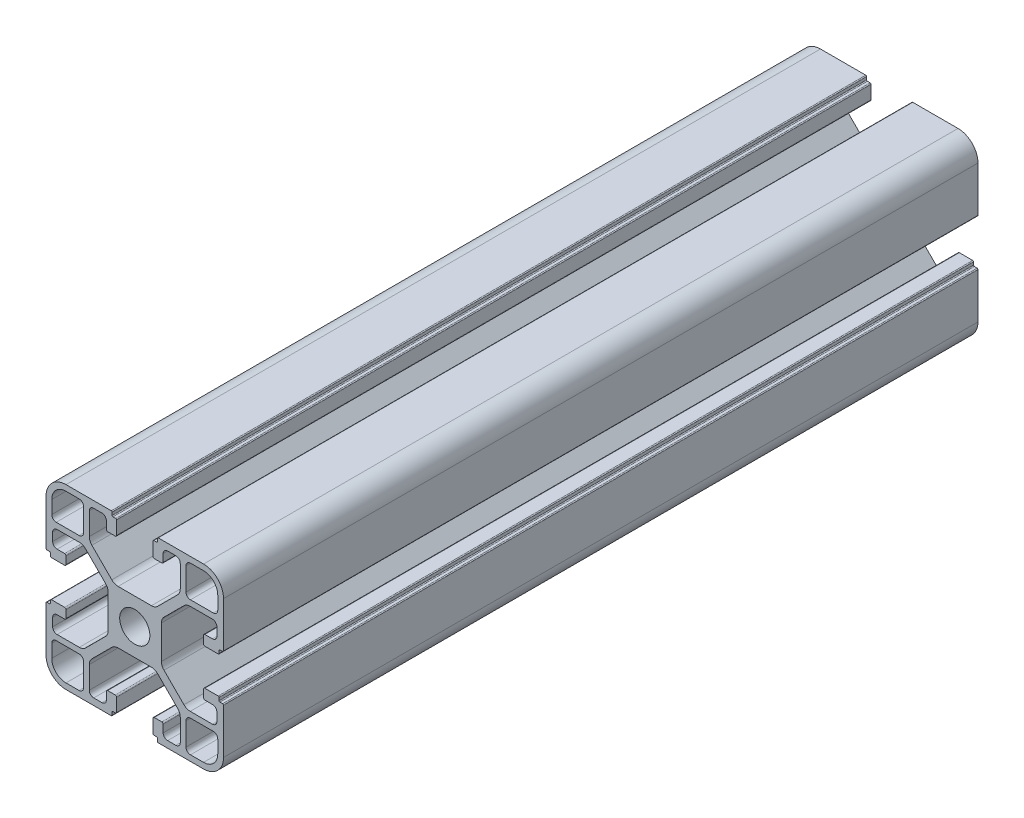
from build123d import *

# Parameters (mm, degrees)
SKETCH2_R           = 3.4
BOSS_EXTRUDE1_DEPTH = 170


with BuildPart() as part:
    # Sketch2 → Boss-Extrude1 (new body)
    with BuildSketch(Plane.XY):
        with BuildLine():
            Line((4.5, 0), (14.7, 0))
            ThreePointArc((14.7, 0), (14.841421356, 0.058578644), (14.9, 0.2))
            Line((14.9, 0.2), (14.9, 0.8))
            ThreePointArc((14.9, 0.8), (14.958578644, 0.941421356), (15.1, 1))
            Line((15.1, 1), (15.7, 1))
            ThreePointArc((15.7, 1), (15.841421356, 1.058578644), (15.9, 1.2))
            Line((15.9, 1.2), (15.9, 4.2))
            ThreePointArc((15.9, 4.2), (15.812132034, 4.412132034), (15.6, 4.5))
            Line((15.6, 4.5), (13.9, 4.5))
            ThreePointArc((13.9, 4.5), (13.687867966, 4.412132034), (13.6, 4.2))
            Line((13.6, 4.2), (13.6, 2.5))
            ThreePointArc((13.6, 2.5), (13.307106781, 1.792893219), (12.6, 1.5))
            Line((12.6, 1.5), (10.75, 1.5))
            ThreePointArc((10.75, 1.5), (10.042893219, 1.792893219), (9.75, 2.5))
            Line((9.75, 2.5), (9.75, 7.507359313))
            ThreePointArc((9.75, 7.507359313), (9.902240935, 8.272726178), (10.335786438, 8.921572875))
            Line((10.335786438, 8.921572875), (14.828427125, 13.414213562))
            ThreePointArc((14.828427125, 13.414213562), (15.477273822, 13.847759065), (16.242640687, 14))
            Line((16.242640687, 14), (23.757359313, 14))
            ThreePointArc((23.757359313, 14), (24.522726178, 13.847759065), (25.171572875, 13.414213562))
            Line((25.171572875, 13.414213562), (29.664213562, 8.921572875))
            ThreePointArc((29.664213562, 8.921572875), (30.097759065, 8.272726178), (30.25, 7.507359313))
            Line((30.25, 7.507359313), (30.25, 2.5))
            ThreePointArc((30.25, 2.5), (29.957106781, 1.792893219), (29.25, 1.5))
            Line((29.25, 1.5), (27.4, 1.5))
            ThreePointArc((27.4, 1.5), (26.692893219, 1.792893219), (26.4, 2.5))
            Line((26.4, 2.5), (26.4, 4.2))
            ThreePointArc((26.4, 4.2), (26.312132034, 4.412132034), (26.1, 4.5))
            Line((26.1, 4.5), (24.4, 4.5))
            ThreePointArc((24.4, 4.5), (24.187867966, 4.412132034), (24.1, 4.2))
            Line((24.1, 4.2), (24.1, 1.2))
            ThreePointArc((24.1, 1.2), (24.158578644, 1.058578644), (24.3, 1))
            Line((24.3, 1), (24.9, 1))
            ThreePointArc((24.9, 1), (25.041421356, 0.941421356), (25.1, 0.8))
            Line((25.1, 0.8), (25.1, 0.2))
            ThreePointArc((25.1, 0.2), (25.158578644, 0.058578644), (25.3, 0))
            Line((25.3, 0), (35.5, 0))
            ThreePointArc((35.5, 0), (38.681980515, 1.318019485), (40, 4.5))
            Line((40, 4.5), (40, 14.7))
            ThreePointArc((40, 14.7), (39.941421356, 14.841421356), (39.8, 14.9))
            Line((39.8, 14.9), (39.2, 14.9))
            ThreePointArc((39.2, 14.9), (39.058578644, 14.958578644), (39, 15.1))
            Line((39, 15.1), (39, 15.7))
            ThreePointArc((39, 15.7), (38.941421356, 15.841421356), (38.8, 15.9))
            Line((38.8, 15.9), (35.8, 15.9))
            ThreePointArc((35.8, 15.9), (35.587867966, 15.812132034), (35.5, 15.6))
            Line((35.5, 15.6), (35.5, 13.9))
            ThreePointArc((35.5, 13.9), (35.587867966, 13.687867966), (35.8, 13.6))
            Line((35.8, 13.6), (37.5, 13.6))
            ThreePointArc((37.5, 13.6), (38.207106781, 13.307106781), (38.5, 12.6))
            Line((38.5, 12.6), (38.5, 10.75))
            ThreePointArc((38.5, 10.75), (38.207106781, 10.042893219), (37.5, 9.75))
            Line((37.5, 9.75), (32.492640687, 9.75))
            ThreePointArc((32.492640687, 9.75), (31.727273822, 9.902240935), (31.078427125, 10.335786438))
            Line((31.078427125, 10.335786438), (26.585786438, 14.828427125))
            ThreePointArc((26.585786438, 14.828427125), (26.152240935, 15.477273822), (26, 16.242640687))
            Line((26, 16.242640687), (26, 23.757359313))
            ThreePointArc((26, 23.757359313), (26.152240935, 24.522726178), (26.585786438, 25.171572875))
            Line((26.585786438, 25.171572875), (31.078427125, 29.664213562))
            ThreePointArc((31.078427125, 29.664213562), (31.727273822, 30.097759065), (32.492640687, 30.25))
            Line((32.492640687, 30.25), (37.5, 30.25))
            ThreePointArc((37.5, 30.25), (38.207106781, 29.957106781), (38.5, 29.25))
            Line((38.5, 29.25), (38.5, 27.4))
            ThreePointArc((38.5, 27.4), (38.207106781, 26.692893219), (37.5, 26.4))
            Line((37.5, 26.4), (35.8, 26.4))
            ThreePointArc((35.8, 26.4), (35.587867966, 26.312132034), (35.5, 26.1))
            Line((35.5, 26.1), (35.5, 24.4))
            ThreePointArc((35.5, 24.4), (35.587867966, 24.187867966), (35.8, 24.1))
            Line((35.8, 24.1), (38.8, 24.1))
            ThreePointArc((38.8, 24.1), (38.941421356, 24.158578644), (39, 24.3))
            Line((39, 24.3), (39, 24.9))
            ThreePointArc((39, 24.9), (39.058578644, 25.041421356), (39.2, 25.1))
            Line((39.2, 25.1), (39.8, 25.1))
            ThreePointArc((39.8, 25.1), (39.941421356, 25.158578644), (40, 25.3))
            Line((40, 25.3), (40, 35.5))
            ThreePointArc((40, 35.5), (38.681980515, 38.681980515), (35.5, 40))
            Line((35.5, 40), (25.3, 40))
            ThreePointArc((25.3, 40), (25.158578644, 39.941421356), (25.1, 39.8))
            Line((25.1, 39.8), (25.1, 39.2))
            ThreePointArc((25.1, 39.2), (25.041421356, 39.058578644), (24.9, 39))
            Line((24.9, 39), (24.3, 39))
            ThreePointArc((24.3, 39), (24.158578644, 38.941421356), (24.1, 38.8))
            Line((24.1, 38.8), (24.1, 35.8))
            ThreePointArc((24.1, 35.8), (24.187867966, 35.587867966), (24.4, 35.5))
            Line((24.4, 35.5), (26.1, 35.5))
            ThreePointArc((26.1, 35.5), (26.312132034, 35.587867966), (26.4, 35.8))
            Line((26.4, 35.8), (26.4, 37.5))
            ThreePointArc((26.4, 37.5), (26.692893219, 38.207106781), (27.4, 38.5))
            Line((27.4, 38.5), (29.25, 38.5))
            ThreePointArc((29.25, 38.5), (29.957106781, 38.207106781), (30.25, 37.5))
            Line((30.25, 37.5), (30.25, 32.492640687))
            ThreePointArc((30.25, 32.492640687), (30.097759065, 31.727273822), (29.664213562, 31.078427125))
            Line((29.664213562, 31.078427125), (25.171572875, 26.585786438))
            ThreePointArc((25.171572875, 26.585786438), (24.522726178, 26.152240935), (23.757359313, 26))
            Line((23.757359313, 26), (16.242640687, 26))
            ThreePointArc((16.242640687, 26), (15.477273822, 26.152240935), (14.828427125, 26.585786438))
            Line((14.828427125, 26.585786438), (10.335786438, 31.078427125))
            ThreePointArc((10.335786438, 31.078427125), (9.902240935, 31.727273822), (9.75, 32.492640687))
            Line((9.75, 32.492640687), (9.75, 37.5))
            ThreePointArc((9.75, 37.5), (10.042893219, 38.207106781), (10.75, 38.5))
            Line((10.75, 38.5), (12.6, 38.5))
            ThreePointArc((12.6, 38.5), (13.307106781, 38.207106781), (13.6, 37.5))
            Line((13.6, 37.5), (13.6, 35.8))
            ThreePointArc((13.6, 35.8), (13.687867966, 35.587867966), (13.9, 35.5))
            Line((13.9, 35.5), (15.6, 35.5))
            ThreePointArc((15.6, 35.5), (15.812132034, 35.587867966), (15.9, 35.8))
            Line((15.9, 35.8), (15.9, 38.8))
            ThreePointArc((15.9, 38.8), (15.841421356, 38.941421356), (15.7, 39))
            Line((15.7, 39), (15.1, 39))
            ThreePointArc((15.1, 39), (14.958578644, 39.058578644), (14.9, 39.2))
            Line((14.9, 39.2), (14.9, 39.8))
            ThreePointArc((14.9, 39.8), (14.841421356, 39.941421356), (14.7, 40))
            Line((14.7, 40), (4.5, 40))
            ThreePointArc((4.5, 40), (1.318019485, 38.681980515), (0, 35.5))
            Line((0, 35.5), (0, 25.3))
            ThreePointArc((0, 25.3), (0.058578644, 25.158578644), (0.2, 25.1))
            Line((0.2, 25.1), (0.8, 25.1))
            ThreePointArc((0.8, 25.1), (0.941421356, 25.041421356), (1, 24.9))
            Line((1, 24.9), (1, 24.3))
            ThreePointArc((1, 24.3), (1.058578644, 24.158578644), (1.2, 24.1))
            Line((1.2, 24.1), (4.2, 24.1))
            ThreePointArc((4.2, 24.1), (4.412132034, 24.187867966), (4.5, 24.4))
            Line((4.5, 24.4), (4.5, 26.1))
            ThreePointArc((4.5, 26.1), (4.412132034, 26.312132034), (4.2, 26.4))
            Line((4.2, 26.4), (2.5, 26.4))
            ThreePointArc((2.5, 26.4), (1.792893219, 26.692893219), (1.5, 27.4))
            Line((1.5, 27.4), (1.5, 29.25))
            ThreePointArc((1.5, 29.25), (1.792893219, 29.957106781), (2.5, 30.25))
            Line((2.5, 30.25), (7.507359313, 30.25))
            ThreePointArc((7.507359313, 30.25), (8.272726178, 30.097759065), (8.921572875, 29.664213562))
            Line((8.921572875, 29.664213562), (13.414213562, 25.171572875))
            ThreePointArc((13.414213562, 25.171572875), (13.847759065, 24.522726178), (14, 23.757359313))
            Line((14, 23.757359313), (14, 16.242640687))
            ThreePointArc((14, 16.242640687), (13.847759065, 15.477273822), (13.414213562, 14.828427125))
            Line((13.414213562, 14.828427125), (8.921572875, 10.335786438))
            ThreePointArc((8.921572875, 10.335786438), (8.272726178, 9.902240935), (7.507359313, 9.75))
            Line((7.507359313, 9.75), (2.5, 9.75))
            ThreePointArc((2.5, 9.75), (1.792893219, 10.042893219), (1.5, 10.75))
            Line((1.5, 10.75), (1.5, 12.6))
            ThreePointArc((1.5, 12.6), (1.792893219, 13.307106781), (2.5, 13.6))
            Line((2.5, 13.6), (4.2, 13.6))
            ThreePointArc((4.2, 13.6), (4.412132034, 13.687867966), (4.5, 13.9))
            Line((4.5, 13.9), (4.5, 15.6))
            ThreePointArc((4.5, 15.6), (4.412132034, 15.812132034), (4.2, 15.9))
            Line((4.2, 15.9), (1.2, 15.9))
            ThreePointArc((1.2, 15.9), (1.058578644, 15.841421356), (1, 15.7))
            Line((1, 15.7), (1, 15.1))
            ThreePointArc((1, 15.1), (0.941421356, 14.958578644), (0.8, 14.9))
            Line((0.8, 14.9), (0.2, 14.9))
            ThreePointArc((0.2, 14.9), (0.058578644, 14.841421356), (0, 14.7))
            Line((0, 14.7), (0, 4.5))
            ThreePointArc((0, 4.5), (1.318019485, 1.318019485), (4.5, 0))
        make_face()
        with Locations((20, 20)):
            Circle(SKETCH2_R, mode=Mode.SUBTRACT)
        with BuildLine():
            Line((31.55, 37.7), (31.55, 32.55))
            ThreePointArc((31.55, 32.55), (31.842893219, 31.842893219), (32.55, 31.55))
            Line((32.55, 31.55), (37.7, 31.55))
            ThreePointArc((37.7, 31.55), (38.407106781, 31.842893219), (38.7, 32.55))
            Line((38.7, 32.55), (38.7, 35.5))
            ThreePointArc((38.7, 35.5), (37.7627417, 37.7627417), (35.5, 38.7))
            Line((35.5, 38.7), (32.55, 38.7))
            ThreePointArc((32.55, 38.7), (31.842893219, 38.407106781), (31.55, 37.7))
        make_face(mode=Mode.SUBTRACT)
        with BuildLine():
            Line((1.3, 35.5), (1.3, 32.55))
            ThreePointArc((1.3, 32.55), (1.592893219, 31.842893219), (2.3, 31.55))
            Line((2.3, 31.55), (7.45, 31.55))
            ThreePointArc((7.45, 31.55), (8.157106781, 31.842893219), (8.45, 32.55))
            Line((8.45, 32.55), (8.45, 37.7))
            ThreePointArc((8.45, 37.7), (8.157106781, 38.407106781), (7.45, 38.7))
            Line((7.45, 38.7), (4.5, 38.7))
            ThreePointArc((4.5, 38.7), (2.2372583, 37.7627417), (1.3, 35.5))
        make_face(mode=Mode.SUBTRACT)
        with BuildLine():
            Line((1.3, 7.45), (1.3, 4.5))
            ThreePointArc((1.3, 4.5), (2.2372583, 2.2372583), (4.5, 1.3))
            Line((4.5, 1.3), (7.45, 1.3))
            ThreePointArc((7.45, 1.3), (8.157106781, 1.592893219), (8.45, 2.3))
            Line((8.45, 2.3), (8.45, 7.45))
            ThreePointArc((8.45, 7.45), (8.157106781, 8.157106781), (7.45, 8.45))
            Line((7.45, 8.45), (2.3, 8.45))
            ThreePointArc((2.3, 8.45), (1.592893219, 8.157106781), (1.3, 7.45))
        make_face(mode=Mode.SUBTRACT)
        with BuildLine():
            Line((31.55, 7.45), (31.55, 2.3))
            ThreePointArc((31.55, 2.3), (31.842893219, 1.592893219), (32.55, 1.3))
            Line((32.55, 1.3), (35.5, 1.3))
            ThreePointArc((35.5, 1.3), (37.7627417, 2.2372583), (38.7, 4.5))
            Line((38.7, 4.5), (38.7, 7.45))
            ThreePointArc((38.7, 7.45), (38.407106781, 8.157106781), (37.7, 8.45))
            Line((37.7, 8.45), (32.55, 8.45))
            ThreePointArc((32.55, 8.45), (31.842893219, 8.157106781), (31.55, 7.45))
        make_face(mode=Mode.SUBTRACT)
    extrude(amount=BOSS_EXTRUDE1_DEPTH)


solid = part.part
